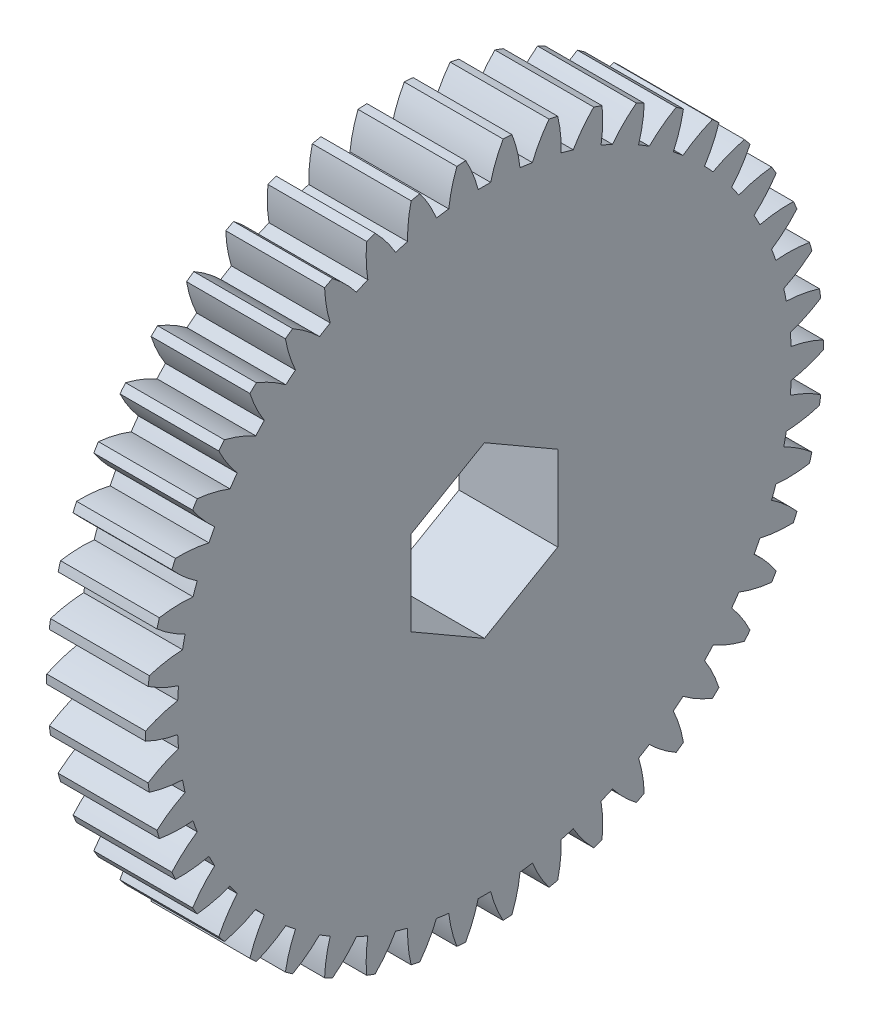
from build123d import *

# Parameters (mm, degrees)
BASPROSKE_W           = 10
BASPROSKE_H           = 24
TOOTHCUT_DEPTH        = 36.383612026
TEETHCUTS_COUNT       = 46
TEETHCUTS_ANGLE       = 352.173913043
BORSKE_R              = 5
BORE_DEPTH            = 50.0000508
ESBO_O1_R             = 26.203846673
CORTE_EXTRUS_O1_DEPTH = 3
CORTE_EXTRUS_O2_DEPTH = 35.630130932


with BuildPart() as part:
    # BasProSke → Base-Revolve (revolve)
    with BuildSketch(Plane(origin=(0, 0, 0), x_dir=(1, 0, 0), z_dir=(0, 1, 0)), mode=Mode.PRIVATE) as base_revolve_sk:
        with Locations((5, 12)):
            Rectangle(BASPROSKE_W, BASPROSKE_H)
    revolve(base_revolve_sk.sketch.rotate(Axis((-10, 0, 0), (1, 0, 0)), 180), axis=Axis((-10, 0, 0), (1, 0, 0)))

    # TooCutSke → ToothCut (cut, through all)
    with BuildSketch(Plane(origin=(0, 0, 0), x_dir=(0, 0, -1), z_dir=(1, 0, 0))):
        with BuildLine():
            ThreePointArc((0.441526923, 21.744517814), (0, 21.749), (-0.441526923, 21.744517814))
            ThreePointArc((-0.441526923, 21.744517814), (-0.815896613, 22.895874179), (-1.338211282, 23.988101962))
            ThreePointArc((-1.338211282, 23.988101962), (0, 24.0254), (1.338211282, 23.988101962))
            ThreePointArc((1.338211282, 23.988101962), (0.815896613, 22.895874179), (0.441526923, 21.744517814))
        make_face()
    toothcut = extrude(amount=TOOTHCUT_DEPTH, mode=Mode.SUBTRACT)

    # TeethCuts: ToothCut ×46 about axis
    teethcuts_axis = Axis((-10, 0, 0), (1, 0, 0))
    for i in range(1, TEETHCUTS_COUNT):
        add(toothcut.rotate(teethcuts_axis, i * TEETHCUTS_ANGLE / (TEETHCUTS_COUNT - 1)), mode=Mode.SUBTRACT)

    # BorSke → Bore (cut, symmetric)
    with BuildSketch(Plane(origin=(0, 0, 0), x_dir=(0, 0, -1), z_dir=(1, 0, 0))):
        with Locations(Location((0, 0, 0), (0, 0, 180))):
            Circle(BORSKE_R)
    extrude(amount=BORE_DEPTH, both=True, mode=Mode.SUBTRACT)

    # Esboço1 → Corte-extrusão1 (cut)
    with BuildSketch(Plane(origin=(10, 0, 0), x_dir=(0, 0, -1), z_dir=(1, 0, 0))):
        Circle(ESBO_O1_R)
    extrude(amount=-CORTE_EXTRUS_O1_DEPTH, mode=Mode.SUBTRACT)

    # Esboço2 → Corte-extrusão2 (cut, through all)
    with BuildSketch(Plane.ZY):
        Polygon((-5.196152423, 3), (-5.196152423, -3), (0, -6), (5.196152423, -3), (5.196152423, 3), (0, 6), align=None)
    extrude(amount=-CORTE_EXTRUS_O2_DEPTH, mode=Mode.SUBTRACT)


solid = part.part
